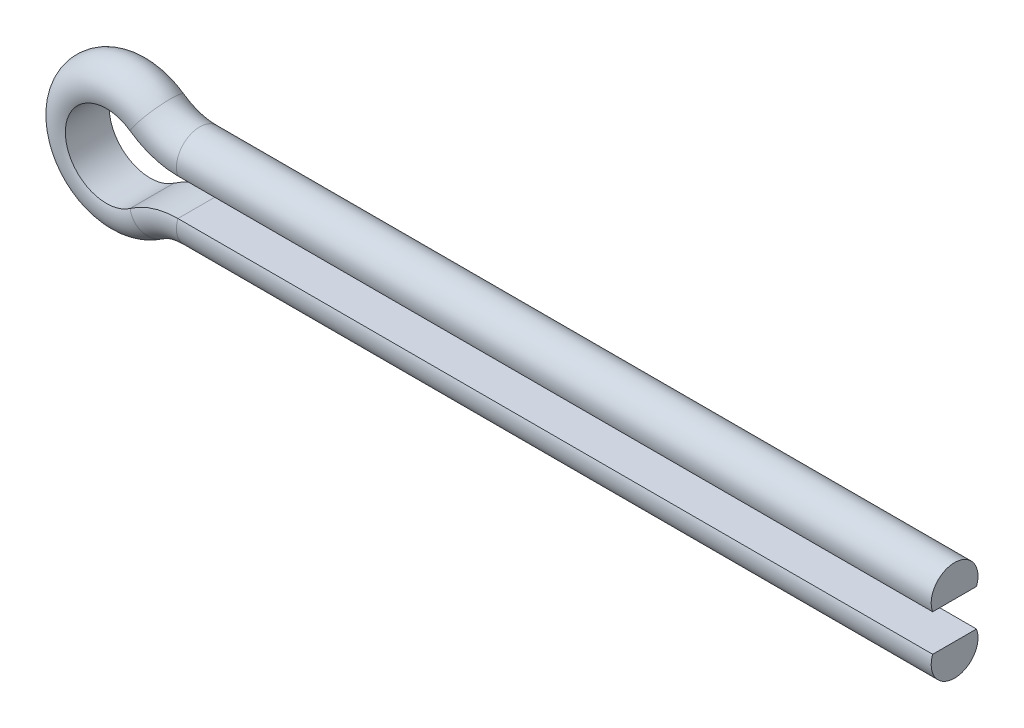
from build123d import *


with BuildPart() as part:
    # Sweep1: sweep along a path in Sketch1
    with BuildLine(Plane.XY) as sweep1_path:
        Line((100, 2.252517363), (8.653081432, 2.252517363))
        ThreePointArc((8.653081432, 2.252517363), (5.626817158, 2.721424847), (2.884360477, 4.084172454))
        ThreePointArc((2.884360477, 4.084172454), (-5, 0), (2.884360477, -4.084172454))
        ThreePointArc((2.884360477, -4.084172454), (5.626817158, -2.721424847), (8.653081432, -2.252517363))
        Line((8.653081432, -2.252517363), (100, -2.252517363))
    # Sketch2 → Sweep1 (sweep)
    with BuildSketch(Plane(origin=(100, 2.252517363, 0), x_dir=(0, 0, -1), z_dir=(1, 0, 0))):
        with BuildLine():
            Line((2.651367996, -0.026532803), (-2.651367996, -0.026532803))
            ThreePointArc((-2.651367996, -0.026532803), (0, 3.807148945), (2.651367996, -0.026532803))
        make_face()
    sweep(path=sweep1_path.line)


solid = part.part
